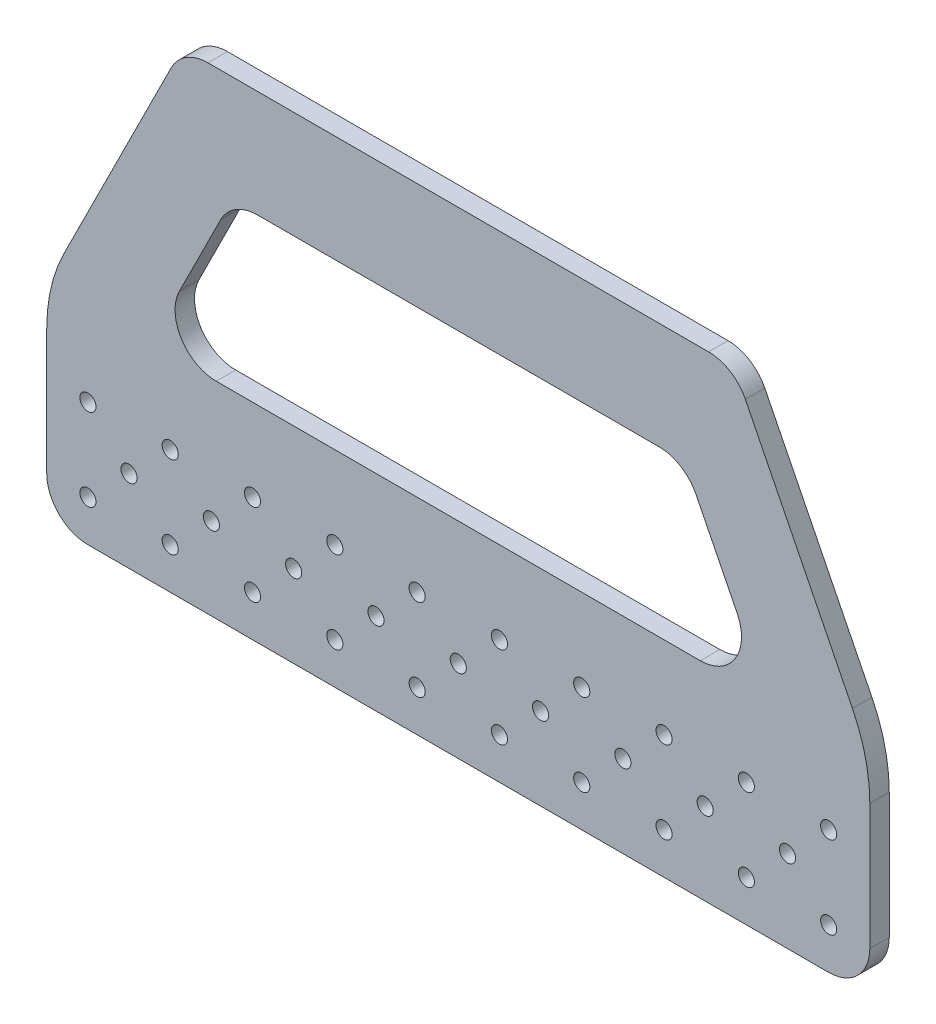
from build123d import *

# Parameters (mm, degrees)
BOSS_EXTRUDE1_DEPTH = 6
SKETCH2_R           = 2.4892
CUT_EXTRUDE1_DEPTH  = 294.692326083


with BuildPart() as part:
    # Sketch1 → Boss-Extrude1 (new body)
    with BuildSketch(Plane.XY):
        with BuildLine():
            Line((12.7, 0), (241.3, 0))
            ThreePointArc((241.3, 0), (250.280256121, 3.719743879), (254, 12.7))
            Line((254, 12.7), (254, 51.507746743))
            ThreePointArc((254, 51.507746743), (252.641048665, 63.179195107), (248.636901303, 74.226197394))
            Line((248.636901303, 74.226197394), (215.600193669, 140.299612663))
            ThreePointArc((215.600193669, 140.299612663), (210.917753467, 145.423265266), (204.240968343, 147.32))
            Line((204.240968343, 147.32), (49.759031657, 147.32))
            ThreePointArc((49.759031657, 147.32), (43.082246533, 145.423265266), (38.399806331, 140.299612663))
            Line((38.399806331, 140.299612663), (5.363098697, 74.226197394))
            ThreePointArc((5.363098697, 74.226197394), (1.358951335, 63.179195107), (0, 51.507746743))
            Line((0, 51.507746743), (0, 12.7))
            ThreePointArc((0, 12.7), (3.719743879, 3.719743879), (12.7, 0))
        make_face()
        with BuildLine():
            Line((40.939806331, 81.879612663), (53.639806331, 107.279612663))
            ThreePointArc((53.639806331, 107.279612663), (58.322246533, 112.403265266), (64.999031657, 114.3))
            Line((64.999031657, 114.3), (189.000968343, 114.3))
            ThreePointArc((189.000968343, 114.3), (195.677753467, 112.403265266), (200.360193669, 107.279612663))
            Line((200.360193669, 107.279612663), (213.060193669, 81.879612663))
            ThreePointArc((213.060193669, 81.879612663), (212.504233609, 69.523214876), (201.700968343, 63.5))
            Line((201.700968343, 63.5), (52.299031657, 63.5))
            ThreePointArc((52.299031657, 63.5), (41.495766391, 69.523214876), (40.939806331, 81.879612663))
        make_face(mode=Mode.SUBTRACT)
    extrude(amount=BOSS_EXTRUDE1_DEPTH)

    # Sketch2 → Cut-Extrude1 (cut, through all)
    with BuildSketch(Plane.XY.offset(6)):
        with Locations((241.3, 12.7)):
            Circle(SKETCH2_R)
        with Locations((215.9, 12.7)):
            Circle(SKETCH2_R)
        with Locations((190.5, 12.7)):
            Circle(SKETCH2_R)
        with Locations((165.1, 12.7)):
            Circle(SKETCH2_R)
        with Locations((139.7, 12.7)):
            Circle(SKETCH2_R)
        with Locations((114.3, 12.7)):
            Circle(SKETCH2_R)
        with Locations((88.9, 12.7)):
            Circle(SKETCH2_R)
        with Locations((63.5, 12.7)):
            Circle(SKETCH2_R)
        with Locations((38.1, 12.7)):
            Circle(SKETCH2_R)
        with Locations((12.7, 12.7)):
            Circle(SKETCH2_R)
        with Locations((215.9, 38.1)):
            Circle(SKETCH2_R)
        with Locations((190.5, 38.1)):
            Circle(SKETCH2_R)
        with Locations((165.1, 38.1)):
            Circle(SKETCH2_R)
        with Locations((139.7, 38.1)):
            Circle(SKETCH2_R)
        with Locations((114.3, 38.1)):
            Circle(SKETCH2_R)
        with Locations((88.9, 38.1)):
            Circle(SKETCH2_R)
        with Locations((63.5, 38.1)):
            Circle(SKETCH2_R)
        with Locations((38.1, 38.1)):
            Circle(SKETCH2_R)
        with Locations((12.7, 38.1)):
            Circle(SKETCH2_R)
        with Locations((241.3, 38.1)):
            Circle(SKETCH2_R)
        with Locations((25.4, 25.4)):
            Circle(SKETCH2_R)
        with Locations((50.8, 25.4)):
            Circle(SKETCH2_R)
        with Locations((76.2, 25.4)):
            Circle(SKETCH2_R)
        with Locations((101.6, 25.4)):
            Circle(SKETCH2_R)
        with Locations((127, 25.4)):
            Circle(SKETCH2_R)
        with Locations((152.4, 25.4)):
            Circle(SKETCH2_R)
        with Locations((177.8, 25.4)):
            Circle(SKETCH2_R)
        with Locations((203.2, 25.4)):
            Circle(SKETCH2_R)
        with Locations((228.6, 25.4)):
            Circle(SKETCH2_R)
    extrude(amount=-CUT_EXTRUDE1_DEPTH, mode=Mode.SUBTRACT)


solid = part.part
